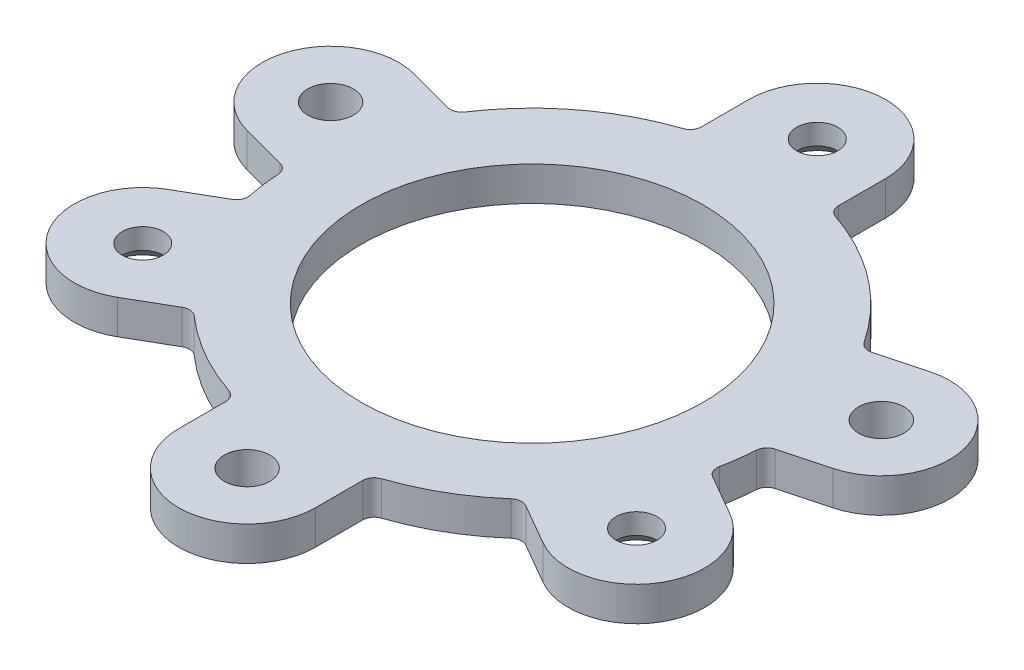
from build123d import *

# Parameters (mm, degrees)
SKETCH1_R           = 1
SKETCH1_R_2         = 0.9
SKETCH1_R_3         = 7.5
BOSS_EXTRUDE1_DEPTH = 1.5
FILLET1_R           = 0.5
CHAMFER1_SIZE       = 0.6


with BuildPart() as part:
    # Sketch1 → Boss-Extrude1 (new body)
    with BuildSketch(Plane(origin=(0, 0, 0), x_dir=(1, 0, 0), z_dir=(0, 1, 0))):
        with BuildLine():
            Line((-10.214212529, -2.433076738), (-12.325317547, -3.651923789))
            ThreePointArc((-12.325317547, -3.651923789), (-13.423393759, -7.75), (-9.325317547, -8.848076211))
            Line((-9.325317547, -8.848076211), (-7.214212529, -7.629229161))
            ThreePointArc((-7.214212529, -7.629229161), (-5.25, -9.09326674), (-3, -10.062305899))
            Line((-3, -10.062305899), (-3, -12.5))
            ThreePointArc((-3, -12.5), (0, -15.5), (3, -12.5))
            Line((3, -12.5), (3, -10.062305899))
            ThreePointArc((3, -10.062305899), (5.25, -9.09326674), (7.214212529, -7.629229161))
            Line((7.214212529, -7.629229161), (9.325317547, -8.848076211))
            ThreePointArc((9.325317547, -8.848076211), (13.423393759, -7.75), (12.325317547, -3.651923789))
            Line((12.325317547, -3.651923789), (10.214212529, -2.433076738))
            ThreePointArc((10.214212529, -2.433076738), (10.410171044, -1.370525018), (10.495898275, -0.293461075))
            Line((10.495898275, -0.293461075), (12.850529964, 0.337460585))
            ThreePointArc((12.850529964, 0.337460585), (14.971850307, 4.011695199), (11.297615693, 6.133015543))
            Line((11.297615693, 6.133015543), (8.942984004, 5.502093883))
            ThreePointArc((8.942984004, 5.502093883), (6.391995005, 8.330210073), (3, 10.062305899))
            Line((3, 10.062305899), (3, 12.5))
            ThreePointArc((3, 12.5), (0, 15.5), (-3, 12.5))
            Line((-3, 12.5), (-3, 10.062305899))
            ThreePointArc((-3, 10.062305899), (-6.391995005, 8.330210073), (-8.942984004, 5.502093883))
            Line((-8.942984004, 5.502093883), (-11.297615693, 6.133015543))
            ThreePointArc((-11.297615693, 6.133015543), (-14.971850307, 4.011695199), (-12.850529964, 0.337460585))
            Line((-12.850529964, 0.337460585), (-10.495898275, -0.293461075))
            ThreePointArc((-10.495898275, -0.293461075), (-10.410171044, -1.370525018), (-10.214212529, -2.433076738))
        make_face()
        with Locations(Location((0, -12.5, 0), (0, 0, 270))):
            Circle(SKETCH1_R, mode=Mode.SUBTRACT)
        with Locations(Location((-10.825317547, -6.25, 0), (0, 0, 270))):
            Circle(SKETCH1_R_2, mode=Mode.SUBTRACT)
        with Locations(Location((10.825317547, -6.25, 0), (0, 0, 270))):
            Circle(SKETCH1_R_2, mode=Mode.SUBTRACT)
        with Locations(Location((0, 0, 0), (0, 0, 270))):
            Circle(SKETCH1_R_3, mode=Mode.SUBTRACT)
        with Locations(Location((0, 12.5, 0), (0, 0, 270))):
            Circle(SKETCH1_R_2, mode=Mode.SUBTRACT)
        with Locations(Location((12.074072829, 3.235238064, 0), (0, 0, 270))):
            Circle(SKETCH1_R, mode=Mode.SUBTRACT)
        with Locations(Location((-12.074072829, 3.235238064, 0), (0, 0, 270))):
            Circle(SKETCH1_R, mode=Mode.SUBTRACT)
    extrude(amount=BOSS_EXTRUDE1_DEPTH)

    # Fillet1
    fillet1_edges = [part.edges().sort_by_distance(p)[0] for p in [
        (-7.214212529, 0.75, 7.629229161),
        (-10.214212529, 0.75, 2.433076738),
        (-10.495898275, 0.75, 0.293461075),
        (-8.942984004, 0.75, -5.502093883),
        (-3, 0.75, -10.062305899),
        (3, 0.75, -10.062305899),
        (8.942984004, 0.75, -5.502093883),
        (10.495898275, 0.75, 0.293461075),
        (10.214212529, 0.75, 2.433076738),
        (7.214212529, 0.75, 7.629229161),
        (3, 0.75, 10.062305899),
        (-3, 0.75, 10.062305899),
    ]]
    fillet(fillet1_edges, radius=FILLET1_R)

    # Chamfer1
    chamfer1_edges = [part.edges().sort_by_distance(p)[0] for p in [
        (10.825317547, 0, 5.35),
        (-10.825317547, 0, 5.35),
        (0, 0, -13.4),
    ]]
    chamfer(chamfer1_edges, length=CHAMFER1_SIZE)


solid = part.part
